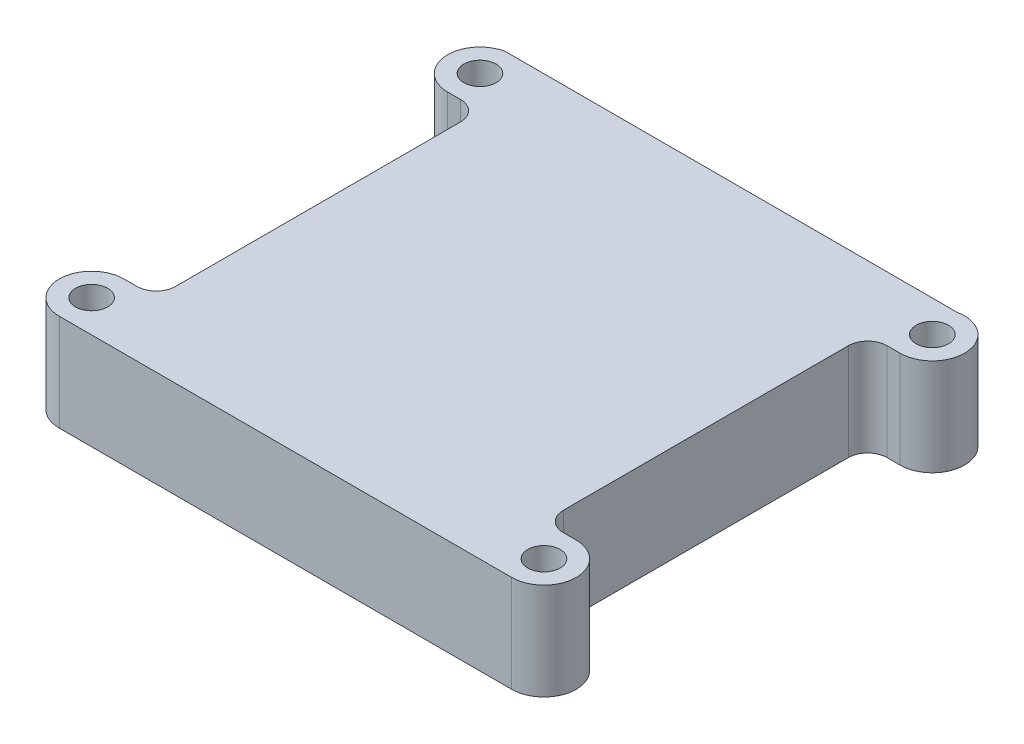
from build123d import *

# Parameters (mm, degrees)
SKETCH1_R           = 2.5
BOSS_EXTRUDE1_DEPTH = 15


with BuildPart() as part:
    # Sketch1 → Boss-Extrude1 (new body)
    with BuildSketch(Plane(origin=(0, 0, 0), x_dir=(1, 0, 0), z_dir=(0, 1, 0))):
        with BuildLine():
            Line((-30, -35), (30, -35))
            Line((30, -35), (35, -35))
            ThreePointArc((35, -35), (40, -30), (35, -25))
            Line((35, -25), (33, -25))
            ThreePointArc((33, -25), (30.878679656, -24.121320344), (30, -22))
            Line((30, -22), (30, 22.098959323))
            ThreePointArc((30, 22.098959323), (30.878679656, 24.220279667), (33, 25.098959323))
            Line((33, 25.098959323), (35, 25.098959323))
            ThreePointArc((35, 25.098959323), (39.975198659, 30.596350827), (34.010151382, 35))
            Line((34.010151382, 35), (30, 35))
            Line((30, 35), (-30, 35))
            Line((-30, 35), (-35.989848618, 35))
            ThreePointArc((-35.989848618, 35), (-39.975198659, 29.601567819), (-35, 25.098959323))
            Line((-35, 25.098959323), (-33, 25.098959323))
            ThreePointArc((-33, 25.098959323), (-30.878679656, 24.220279667), (-30, 22.098959323))
            Line((-30, 22.098959323), (-30, -22))
            ThreePointArc((-30, -22), (-30.878679656, -24.121320344), (-33, -25))
            Line((-33, -25), (-35, -25))
            ThreePointArc((-35, -25), (-40, -30), (-35, -35))
            Line((-35, -35), (-30, -35))
        make_face()
        with Locations(Location((-35, 30.098959323, 0), (0, 0, 270))):
            Circle(SKETCH1_R, mode=Mode.SUBTRACT)
        with Locations(Location((35, 30.098959323, 0), (0, 0, 270))):
            Circle(SKETCH1_R, mode=Mode.SUBTRACT)
        with Locations(Location((35, -30, 0), (0, 0, 270))):
            Circle(SKETCH1_R, mode=Mode.SUBTRACT)
        with Locations(Location((-35, -30, 0), (0, 0, 270))):
            Circle(SKETCH1_R, mode=Mode.SUBTRACT)
    extrude(amount=BOSS_EXTRUDE1_DEPTH)


solid = part.part
